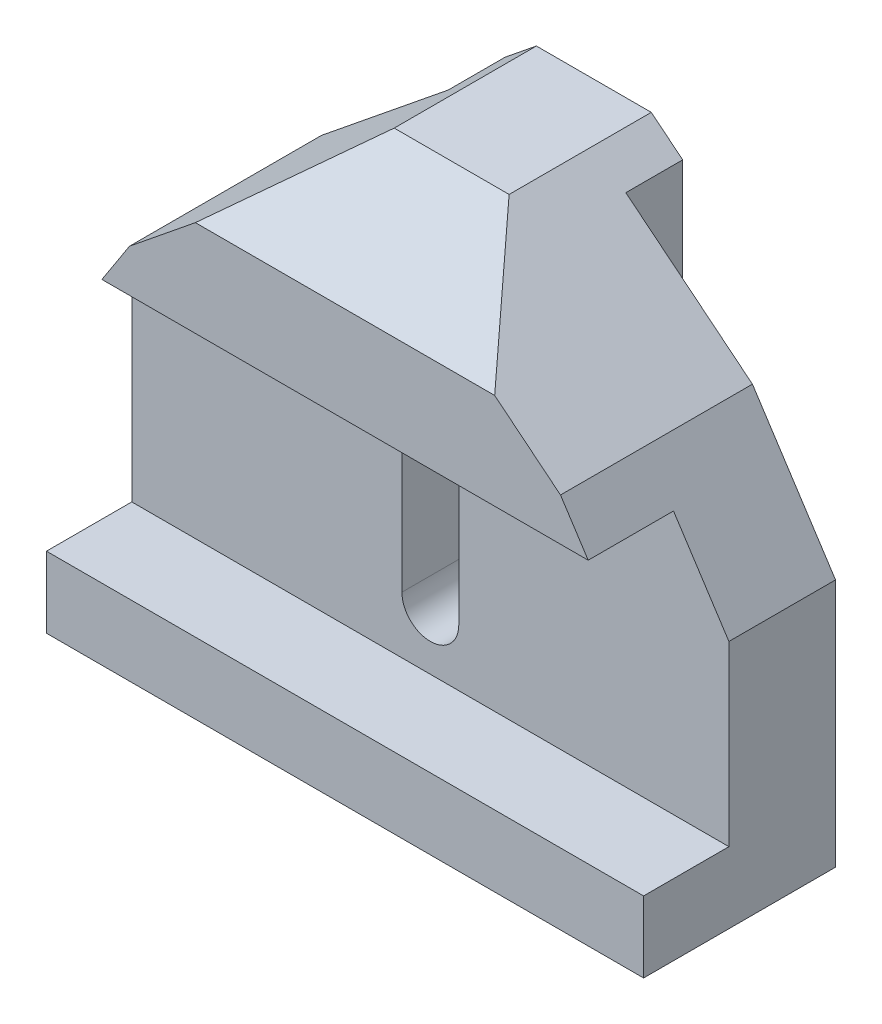
from build123d import *

# Parameters (mm, degrees)
SKETCH1_W           = 8
SKETCH1_H           = 71
BOSS_EXTRUDE1_DEPTH = 12.5
BOSS_EXTRUDE2_DEPTH = 42
CUT_EXTRUDE1_REACH  = 91.61
CHAMFER1_SIZE       = 15
CHAMFER1_SIZE2      = 10.503113073


with BuildPart() as part:
    # Sketch1 → Boss-Extrude1 (new, symmetric)
    with BuildSketch(Plane(origin=(0, 0, 0), x_dir=(0, 0, -1), z_dir=(1, 0, 0))):
        with Locations((-4, 35.5)):
            Rectangle(SKETCH1_W, SKETCH1_H)
    extrude(amount=BOSS_EXTRUDE1_DEPTH, both=True)

    # Sketch1<3> → Boss-Extrude2 (add, symmetric)
    with BuildSketch(Plane(origin=(0, 0, 0), x_dir=(0, 0, -1), z_dir=(1, 0, 0))):
        Polygon((-35, 0), (-8, 0), (-8, 71), (-35, 71), (-35, 47), (-23, 47), (-23, 10), (-35, 10), align=None)
    extrude(amount=BOSS_EXTRUDE2_DEPTH, both=True)

    # Sketch2 → Cut-Extrude1 (cut, up to next)
    with BuildSketch(Plane.XY, mode=Mode.PRIVATE) as cut_extrude1_sk1:
        Polygon((42, 71), (8.082514505, 71), (30.310663322, 53), (42, 35), align=None)
    cut_extrude1_tool1 = extrude(cut_extrude1_sk1.sketch, amount=CUT_EXTRUDE1_REACH, mode=Mode.PRIVATE) & part.part
    # Sketch2 → Cut-Extrude1 (cut, up to next)
    with BuildSketch(Plane.XY, mode=Mode.PRIVATE) as cut_extrude1_sk2:
        with BuildLine():
            Line((4, 18), (4, 39))
            ThreePointArc((4, 39), (0, 43), (-4, 39))
            Line((-4, 39), (-4, 18))
            ThreePointArc((-4, 18), (0, 14), (4, 18))
        make_face()
    cut_extrude1_tool2 = extrude(cut_extrude1_sk2.sketch, amount=CUT_EXTRUDE1_REACH, mode=Mode.PRIVATE) & part.part
    # Sketch2 → Cut-Extrude1 (cut, up to next)
    with BuildSketch(Plane.XY, mode=Mode.PRIVATE) as cut_extrude1_sk3:
        Polygon((-8.082514505, 71), (-42, 71), (-42, 35), (-30.310663322, 53), align=None)
    cut_extrude1_tool3 = extrude(cut_extrude1_sk3.sketch, amount=CUT_EXTRUDE1_REACH, mode=Mode.PRIVATE) & part.part
    add(cut_extrude1_tool1.solids().sort_by_distance((31.410867, 60.103615, 0))[0], mode=Mode.SUBTRACT)
    add(cut_extrude1_tool2.solids().sort_by_distance((0, 28.5, 0))[0], mode=Mode.SUBTRACT)
    add(cut_extrude1_tool3.solids().sort_by_distance((-31.410867, 60.103615, 0))[0], mode=Mode.SUBTRACT)

    # Chamfer1
    chamfer1_edges = [part.edges().sort_by_distance(p)[0] for p in [
        (0, 71, 35),
    ]]
    chamfer1_side = [part.faces().sort_by_distance(p)[0] for p in [
        (0, 71, 17.5),
    ]]
    chamfer(chamfer1_edges, length=CHAMFER1_SIZE, length2=CHAMFER1_SIZE2, reference=chamfer1_side[0])


solid = part.part
